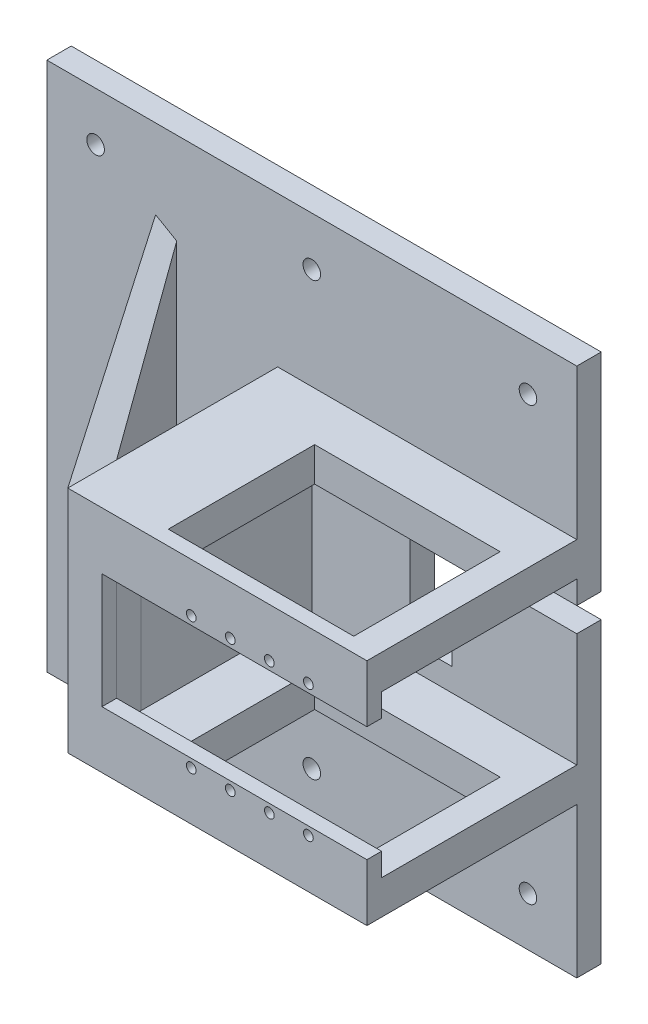
from build123d import *

# Parameters (mm, degrees)
ESQUISSE1_R             = 1.8
BOSS_EXTRU_1_DEPTH      = 5
BOSS_EXTRU_2_DEPTH      = 35
ESQUISSE3_R             = 1
BOSS_EXTRU_3_DEPTH      = 8
ESQUISSE4_W             = 8.59995714
ESQUISSE4_H             = 23.592650329
ENL_V_MAT_EXTRU_1_DEPTH = 5
ESQUISSE8_W             = 5
ESQUISSE8_H             = 33
ENL_V_MAT_EXTRU_2_DEPTH = 54.3
ESQUISSE9_W             = 38
ESQUISSE9_H             = 30
ENL_V_MAT_EXTRU_3_DEPTH = 134.157940401
ENL_V_MAT_EXTRU_4_DEPTH = 74.3


with BuildPart() as part:
    # Esquisse1 → Boss.-Extru.1 (new body)
    with BuildSketch(Plane(origin=(0, 0, 0), x_dir=(-1, 0, 0), z_dir=(0, 0, 1))):
        Polygon((96.824454852, 121.477817805), (96.824454852, 131.477817805), (-1.765545148, 131.477817805), (-11.765545148, 131.477817805), (-11.765545148, 22.887817805), (-1.765545148, 22.887817805), (42.529454852, 22.887817805), (86.824454852, 22.887817805), (96.824454852, 22.887817805), align=None)
        with BuildLine():
            ThreePointArc((0.034454852, 32.887817805), (-0.492752942, 31.615025599), (-1.765545148, 31.087817805))
            ThreePointArc((-1.765545148, 31.087817805), (-3.038337355, 34.160610011), (0.034454852, 32.887817805))
        make_face(mode=Mode.SUBTRACT)
        with BuildLine():
            ThreePointArc((44.329454852, 32.887817805), (43.802247058, 31.615025599), (42.529454852, 31.087817805))
            ThreePointArc((42.529454852, 31.087817805), (40.729454852, 32.887817805), (42.529454852, 34.687817805))
            ThreePointArc((42.529454852, 34.687817805), (43.802247058, 34.160610011), (44.329454852, 32.887817805))
        make_face(mode=Mode.SUBTRACT)
        with BuildLine():
            ThreePointArc((88.624454852, 32.887817805), (88.097247058, 31.615025599), (86.824454852, 31.087817805))
            ThreePointArc((86.824454852, 31.087817805), (85.551662645, 34.160610011), (88.624454852, 32.887817805))
        make_face(mode=Mode.SUBTRACT)
        with BuildLine():
            ThreePointArc((0.034454852, 121.477817805), (-3.038337355, 120.205025599), (-1.765545148, 123.277817805))
            ThreePointArc((-1.765545148, 123.277817805), (-0.492752942, 122.750610011), (0.034454852, 121.477817805))
        make_face(mode=Mode.SUBTRACT)
        with BuildLine():
            ThreePointArc((44.329454852, 121.477817805), (43.802247058, 120.205025599), (42.529454852, 119.677817805))
            ThreePointArc((42.529454852, 119.677817805), (41.256662645, 122.750610011), (44.329454852, 121.477817805))
        make_face(mode=Mode.SUBTRACT)
        with Locations((86.824454852, 121.477817805)):
            Circle(ESQUISSE1_R, mode=Mode.SUBTRACT)
    extrude(amount=BOSS_EXTRU_1_DEPTH)

    # Esquisse2 → Boss.-Extru.2 (add)
    with BuildSketch(Plane.XY.offset(5)):
        Polygon((11.765545148, -53.682817805), (-49.529454852, -53.682817805), (-49.529454852, -100.682817805), (11.765545148, -100.682817805), (11.765545148, -93.682817805), (-42.529454852, -93.682817805), (-42.529454852, -60.682817805), (11.765545148, -60.682817805), align=None)
    extrude(amount=BOSS_EXTRU_2_DEPTH)

    # Esquisse3 → Boss.-Extru.3 (add)
    with BuildSketch(Plane.XY.offset(40)):
        Polygon((-42.529454852, -65.390167476), (11.765545148, -65.390167476), (11.765545148, -53.682817805), (-49.529454852, -53.682817805), (-49.529454852, -100.682817805), (11.765545148, -100.682817805), (11.765545148, -88.982817805), (-42.529454852, -88.982817805), align=None)
        with Locations((-24.229454852, -63.682817805)):
            Circle(ESQUISSE3_R, mode=Mode.SUBTRACT)
        with BuildLine():
            ThreePointArc((-15.229454852, -63.682817805), (-16.229454852, -64.682817805), (-17.229454852, -63.682817805))
            ThreePointArc((-17.229454852, -63.682817805), (-16.229454852, -62.682817805), (-15.229454852, -63.682817805))
        make_face(mode=Mode.SUBTRACT)
        with BuildLine():
            ThreePointArc((-7.229454852, -63.682817805), (-8.229454852, -64.682817805), (-9.229454852, -63.682817805))
            ThreePointArc((-9.229454852, -63.682817805), (-8.229454852, -62.682817805), (-7.229454852, -63.682817805))
        make_face(mode=Mode.SUBTRACT)
        with Locations((-0.229454852, -63.682817805)):
            Circle(ESQUISSE3_R, mode=Mode.SUBTRACT)
        with Locations((-24.229454852, -90.682817805)):
            Circle(ESQUISSE3_R, mode=Mode.SUBTRACT)
        with BuildLine():
            ThreePointArc((-15.229454852, -90.682817805), (-16.229454852, -91.682817805), (-17.229454852, -90.682817805))
            ThreePointArc((-17.229454852, -90.682817805), (-16.229454852, -89.682817805), (-15.229454852, -90.682817805))
        make_face(mode=Mode.SUBTRACT)
        with BuildLine():
            ThreePointArc((-7.229454852, -90.682817805), (-8.229454852, -91.682817805), (-9.229454852, -90.682817805))
            ThreePointArc((-9.229454852, -90.682817805), (-8.229454852, -89.682817805), (-7.229454852, -90.682817805))
        make_face(mode=Mode.SUBTRACT)
        with Locations((-0.229454852, -90.682817805)):
            Circle(ESQUISSE3_R, mode=Mode.SUBTRACT)
    extrude(amount=BOSS_EXTRU_3_DEPTH)

    # Esquisse4 → Enlèv. mat.-Extru.1 (cut)
    with BuildSketch(Plane.XY.offset(5)):
        with Locations((-18.074099951, -77.186492641)):
            Rectangle(ESQUISSE4_W, ESQUISSE4_H)
    extrude(amount=-ENL_V_MAT_EXTRU_1_DEPTH, mode=Mode.SUBTRACT)

    # Esquisse5 → Lissage3 section 0
    with BuildSketch(Plane.ZY.offset(49.529454852)):
        with BuildLine():
            Line((48, -100.682817805), (38, -100.682817805))
            Line((38, -100.682817805), (38, -53.682817805))
            Line((38, -53.682817805), (48, -53.682817805))
            Line((48, -53.682817805), (48, -100.682817805))
        make_face()
    # Esquisse6 → Lissage3 section 1
    with BuildSketch(Plane.XY.offset(5)):
        with BuildLine():
            Line((-74.529454852, -115.182817805), (-74.529454852, -39.182817805))
            Line((-74.529454852, -39.182817805), (-70.204298905, -41.691408254))
            Line((-70.204298905, -41.691408254), (-70.204298905, -112.674227356))
            Line((-70.204298905, -112.674227356), (-74.529454852, -115.182817805))
        make_face()
    loft()

    # Esquisse8 → Enlèv. mat.-Extru.2 (cut)
    with BuildSketch(Plane(origin=(11.765545148, 0, 0), x_dir=(0, 0, -1), z_dir=(1, 0, 0))):
        with Locations((-42.5, -77.182817805)):
            Rectangle(ESQUISSE8_W, ESQUISSE8_H)
    extrude(amount=-ENL_V_MAT_EXTRU_2_DEPTH, mode=Mode.SUBTRACT)

    # Esquisse9 → Enlèv. mat.-Extru.3 (cut, through all)
    with BuildSketch(Plane(origin=(0, -53.682817805, 0), x_dir=(1, 0, 0), z_dir=(0, 1, 0))):
        with Locations((-12.943096448, -30)):
            Rectangle(ESQUISSE9_W, ESQUISSE9_H)
    extrude(amount=-ENL_V_MAT_EXTRU_3_DEPTH, mode=Mode.SUBTRACT)

    # Esquisse10 → Enlèv. mat.-Extru.4 (cut)
    with BuildSketch(Plane.XY.offset(5)):
        Polygon((-13.774121381, -65.390167476), (11.765545148, -65.390167476), (11.765545148, -70.390167476), (-5.389368853, -70.390167476), (-13.774121381, -75.390167476), align=None)
    extrude(amount=-ENL_V_MAT_EXTRU_4_DEPTH, mode=Mode.SUBTRACT)


solid = part.part
